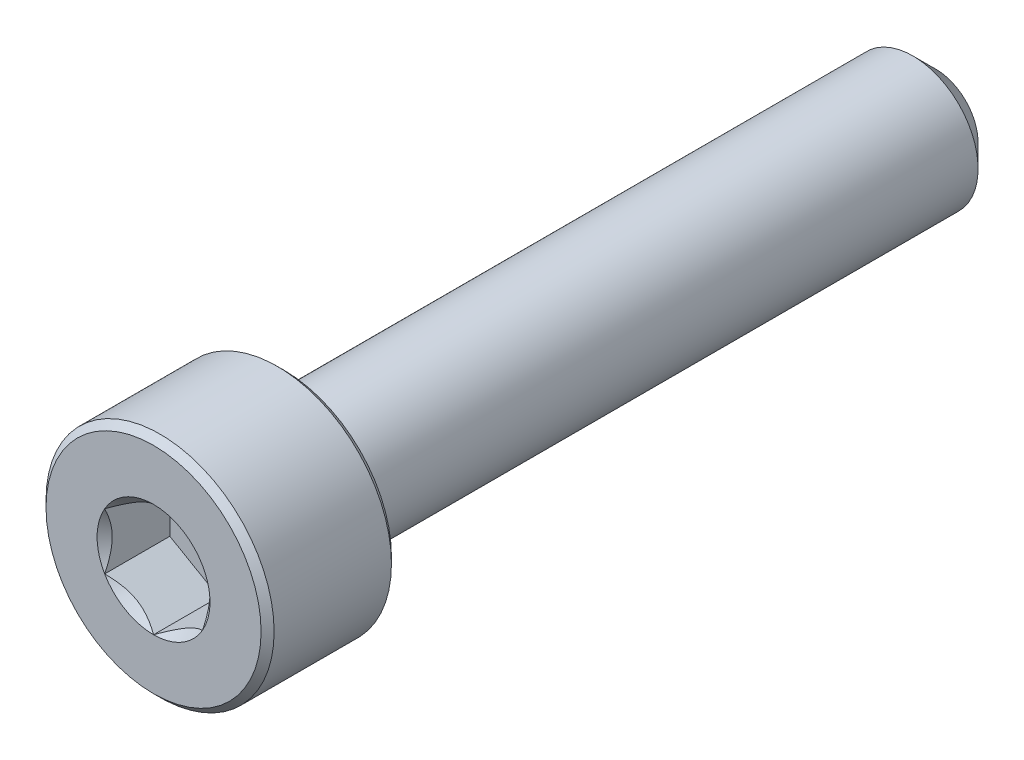
from build123d import *

# Parameters (mm, degrees)
CUT_EXTRUDE1_START = -2
CUT_EXTRUDE1_DEPTH = 2
SKETCH4_R          = 1.732050808
CUT_EXTRUDE2_DEPTH = 0.5
CUT_EXTRUDE2_DRAFT = -45


with BuildPart() as part:
    # Sketch2 → Revolve1 (revolve)
    with BuildSketch(Plane(origin=(0, 0, 0), x_dir=(0, 0, -1), z_dir=(1, 0, 0)), mode=Mode.PRIVATE) as revolve1_sk:
        Polygon((-11.8, 3.5), (-8.2, 3.5), (-8, 3.3), (-8, 2), (11.3, 2), (12, 1.3), (12, 0), (-12, 0), (-12, 3.3), align=None)
    revolve(revolve1_sk.sketch.rotate(Axis((0, 0, -12), (0, 0, 1)), 90), axis=Axis((0, 0, -12), (0, 0, 1)))

    # Sketch3 → Cut-Extrude1 (cut)
    with BuildSketch(Plane.XY.offset(12).offset(CUT_EXTRUDE1_START)):
        Polygon((0, 1.732050808), (-1.5, 0.866025404), (-1.5, -0.866025404), (0, -1.732050808), (1.5, -0.866025404), (1.5, 0.866025404), align=None)
    extrude(amount=CUT_EXTRUDE1_DEPTH, mode=Mode.SUBTRACT)


with BuildPart() as cut_extrude2_tool:
    # Sketch4 → Cut-Extrude2 (with draft: the straight prism first)
    with BuildSketch(Plane.XY.offset(12)):
        Circle(SKETCH4_R)
    extrude(amount=-CUT_EXTRUDE2_DEPTH)
    # Cut-Extrude2: the draft: its side faces are tilted about the plane it starts from
    cut_extrude2_sides = [cut_extrude2_tool.faces().sort_by_distance(p)[0] for p in [
        (-1.732050808, 0, 11.75),
    ]]
    draft(cut_extrude2_sides, Plane.XY.offset(12), CUT_EXTRUDE2_DRAFT)


with BuildPart() as part_1:
    add(part.part)

    # Cut-Extrude2: cut by cut_extrude2_tool
    add(cut_extrude2_tool.part, mode=Mode.SUBTRACT)


solid = part_1.part
